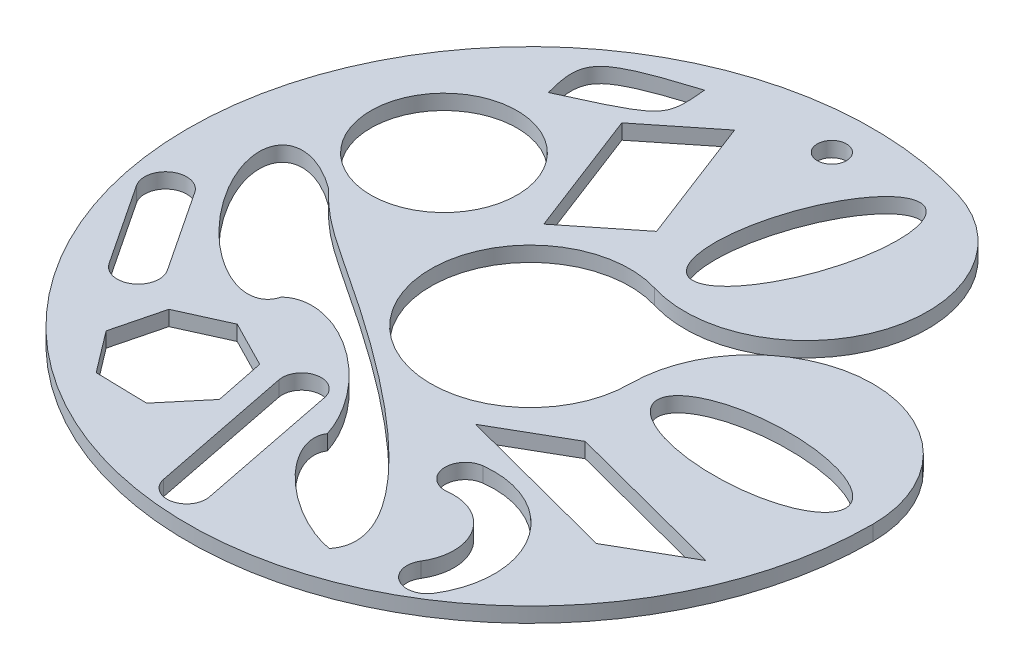
from build123d import *

# Parameters (mm, degrees)
SKETCH3_R           = 12.358895311
SKETCH3_R_2         = 2.464097651
SKETCH3_RX          = 15.890344847
SKETCH3_RY          = 6.252747063
SKETCH3_RX_2        = 15.884289383
SKETCH3_RY_2        = 6.323263158
BOSS_EXTRUDE3_DEPTH = 2.54


with BuildPart() as part:
    # Sketch3 → Boss-Extrude3 (new body)
    with BuildSketch(Plane(origin=(0, 0, 0), x_dir=(1, 0, 0), z_dir=(0, 1, 0))):
        with BuildLine():
            ThreePointArc((16.863436343, 55.375878801), (-46.513606384, -34.457914322), (57.886643004, 0))
            ThreePointArc((57.886643004, 0), (37.353973593, 20.532669411), (16.821304183, 0))
            ThreePointArc((16.821304183, 0), (-13.51640864, -10.013139962), (4.900353131, 16.091700146))
            ThreePointArc((4.900353131, 16.091700146), (30.523984064, 29.752247868), (16.863436343, 55.375878801))
        make_face()
        with Locations(Location((-32.68730189, 18.079259895, 0), (0, 0, 270))):
            Circle(SKETCH3_R, mode=Mode.SUBTRACT)
        with Locations(Location((0, 50.934909537, 0), (0, 0, 270))):
            Circle(SKETCH3_R_2, mode=Mode.SUBTRACT)
        with Locations(Location((10.881894737, 35.733789474), (0, 0, -106.936895049))):
            Ellipse(SKETCH3_RX, SKETCH3_RY, mode=Mode.SUBTRACT)
        with Locations(Location((37.353973593, 0), (0, 0, 180))):
            Ellipse(SKETCH3_RX_2, SKETCH3_RY_2, mode=Mode.SUBTRACT)
        Polygon((-11.470105263, 45.96451038), (-3.235157895, 24.557789474), (-13.822947368, 16.091700146), (-22.057894737, 37.498421053), align=None, mode=Mode.SUBTRACT)
        Polygon((21.469684211, -12.205368421), (49.11818412, -19.439027927), (37.353973593, -26.203448979), (9.705473684, -18.969789474), align=None, mode=Mode.SUBTRACT)
        Polygon((-17.315479632, -28.424679662), (-25.08637222, -24.449858293), (-33.039084983, -28.047126178), (-35.185063006, -36.507667228), (-29.908341066, -43.46052147), (-21.18239841, -43.670047846), (-15.578047835, -36.978468722), align=None, mode=Mode.SUBTRACT)
        with BuildLine():
            Line((-44.781699634, -26.412027794), (-53.891075692, -12.664426795))
            ThreePointArc((-53.891075692, -12.664426795), (-52.891997, -7.741009102), (-47.968579306, -8.740087794))
            Line((-47.968579306, -8.740087794), (-38.859203248, -22.487688793))
            ThreePointArc((-38.859203248, -22.487688793), (-39.85828194, -27.411106486), (-44.781699634, -26.412027794))
        make_face(mode=Mode.SUBTRACT)
        with BuildLine():
            Line((-6.966070099, -27.813792225), (-2.161956477, -52.065958521))
            ThreePointArc((-2.161956477, -52.065958521), (-4.749380107, -55.931687729), (-8.615109315, -53.344264099))
            Line((-8.615109315, -53.344264099), (-13.419222937, -29.092097803))
            ThreePointArc((-13.419222937, -29.092097803), (-10.831799307, -25.226368595), (-6.966070099, -27.813792225))
        make_face(mode=Mode.SUBTRACT)
        with BuildLine():
            ThreePointArc((30.886886149, -47.244480889), (30.858829329, -31.255415741), (16.406418198, -24.415912541))
            ThreePointArc((16.406418198, -24.415912541), (13.423424498, -28.22867821), (17.236190167, -31.21167191))
            ThreePointArc((17.236190167, -31.21167191), (25.077566237, -34.922548678), (25.092788893, -43.597659821))
            ThreePointArc((25.092788893, -43.597659821), (26.166426987, -48.318118983), (30.886886149, -47.244480889))
        make_face(mode=Mode.SUBTRACT)
        with BuildLine():
            add(Edge.make_bspline(
                [(-37.224246313, 3.110438823), (-61.658549034, 21.290294434), (-45.618310828, -5.517015367), (-29.578072621, -32.324325169), (-25.327826736, -16.771498154)],
                knots=[5.191011334, 5.191011334, 5.191011334, 7.442291905, 7.442291905, 9.693572477, 9.693572477, 9.693572477], degree=2, weights=[1, 0.43059872, 1, 0.43059872, 1]))
            add(Edge.make_bspline(
                [(-1.454023545, -32.868118691), (-10.929764001, -2.855902976), (-25.327826736, -16.771498154)],
                knots=[3.935097044, 3.935097044, 3.935097044, 6.283185307, 6.283185307, 6.283185307], degree=2, weights=[1, 0.386424867, 1]))
            add(Edge.make_bspline(
                [(-1.454023545, -32.868118691), (-9.856799006, -45.028908521), (15.51104241, -49.507809486)],
                knots=[0, 0, 0, 2.383739829, 2.383739829, 2.383739829], degree=2, weights=[1, 0.369923253, 1]))
            add(Edge.make_bspline(
                [(15.51104241, -49.507809486), (25.653042134, -37.078339164), (-27.805109675, -3.440180976), (-27.805109675, -6.510884213), (-37.224246313, 3.110438823)],
                knots=[0, 0, 0, 0, 0, 1, 1, 1, 1, 1], degree=4))
        make_face(mode=Mode.SUBTRACT)
        with BuildLine():
            add(Edge.make_bspline(
                [(-32.68730189, 35.733789474), (-35.185063006, 44.509042558), (-19.85530503, 49.26893673)],
                knots=[0, 0, 0, 1, 1, 1], degree=2, weights=[1, 2.02313102, 1]))
            add(Edge.make_bspline(
                [(-32.68730189, 35.733789474), (-19.000257161, 41.875909611), (-19.85530503, 49.26893673)],
                knots=[0, 0, 0, 1, 1, 1], degree=2, weights=[1, 2.762803935, 1]))
        make_face(mode=Mode.SUBTRACT)
    extrude(amount=BOSS_EXTRUDE3_DEPTH)


solid = part.part
